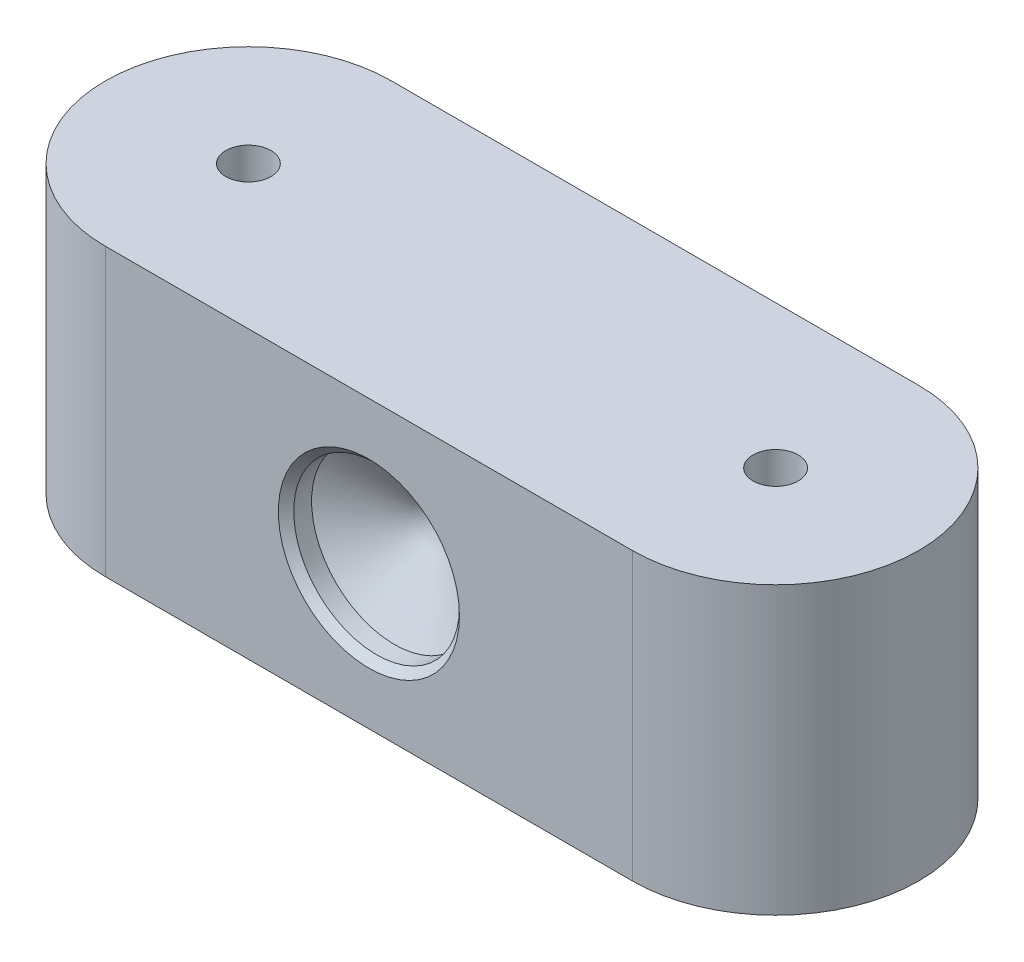
from build123d import *

# Parameters (mm, degrees)
SKETCH1_R           = 3
BOSS_EXTRUDE1_DEPTH = 19


with BuildPart() as part:
    # Sketch1 → Boss-Extrude1 (new, symmetric)
    with BuildSketch(Plane(origin=(0, 0, 0), x_dir=(1, 0, 0), z_dir=(0, 1, 0))):
        with BuildLine():
            Line((-35, 19), (35, 19))
            ThreePointArc((35, 19), (54, 0), (35, -19))
            Line((35, -19), (-35, -19))
            ThreePointArc((-35, -19), (-54, 0), (-35, 19))
        make_face()
        with Locations(Location((-35, 0, 0), (0, 0, 270))):
            Circle(SKETCH1_R, mode=Mode.SUBTRACT)
        with Locations(Location((35, 0, 0), (0, 0, 270))):
            Circle(SKETCH1_R, mode=Mode.SUBTRACT)
    extrude(amount=BOSS_EXTRUDE1_DEPTH, both=True)

    # Sketch3 → M24x2.0 Tapped Hole1 (revolve, cut)
    with BuildSketch(Plane(origin=(0, 0, 19), x_dir=(0, -1, 0), z_dir=(1, 0, 0))):
        Polygon((0, 0), (0, 10), (11, 3.390533191), (11, 1.025), (12.025, 0), align=None)
    revolve(axis=Axis((0, 0, 25.35), (0, 0, -1)), mode=Mode.SUBTRACT)


solid = part.part
